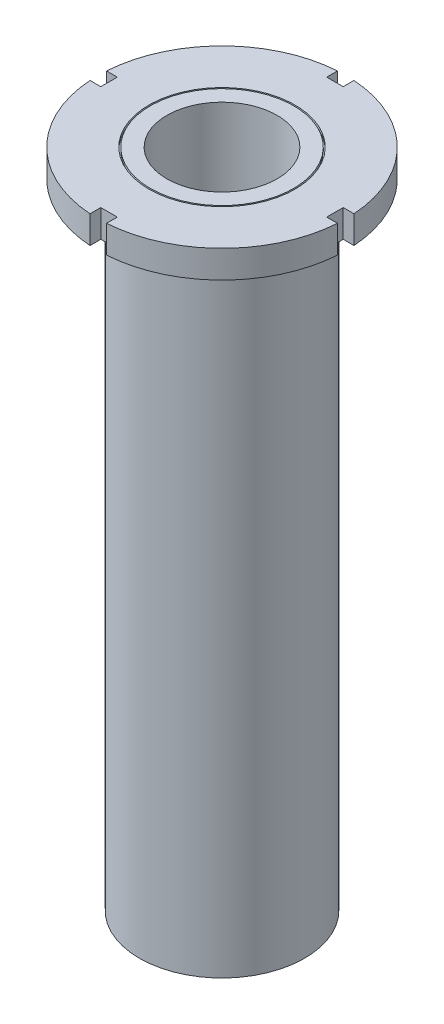
from build123d import *

# Parameters (mm, degrees)
SKETCH1_R           = 15
BOSS_EXTRUDE1_DEPTH = 115
BOSS_EXTRUDE2_DEPTH = 5
SKETCH3_R           = 13.25
SKETCH3_R_2         = 13
CUT_EXTRUDE1_DEPTH  = 0.5
SKETCH4_R           = 10
CUT_EXTRUDE2_DEPTH  = 125.128965193
SKETCH5_R           = 1.5
BOSS_EXTRUDE3_DEPTH = 10.35


with BuildPart() as part:
    # Sketch1 → Boss-Extrude1 (new body)
    with BuildSketch(Plane(origin=(0, 0, 0), x_dir=(1, 0, 0), z_dir=(0, 1, 0))):
        with Locations(Location((0, 0, 0), (0, 0, 270))):
            Circle(SKETCH1_R)
    extrude(amount=BOSS_EXTRUDE1_DEPTH)

    # Sketch2 → Boss-Extrude2 (add)
    with BuildSketch(Plane(origin=(0, 115, 0), x_dir=(1, 0, 0), z_dir=(0, 1, 0))):
        with BuildLine():
            Line((-1.5, 20.5), (1.5, 20.5))
            Line((1.5, 20.5), (1.5, 22.449944321))
            ThreePointArc((1.5, 22.449944321), (15.909902577, 15.909902577), (22.449944321, 1.5))
            Line((22.449944321, 1.5), (20.5, 1.5))
            Line((20.5, 1.5), (20.5, -1.5))
            Line((20.5, -1.5), (22.449944321, -1.5))
            ThreePointArc((22.449944321, -1.5), (15.909902577, -15.909902577), (1.5, -22.449944321))
            Line((1.5, -22.449944321), (1.5, -20.5))
            Line((1.5, -20.5), (-1.5, -20.5))
            Line((-1.5, -20.5), (-1.5, -22.449944321))
            ThreePointArc((-1.5, -22.449944321), (-15.909902577, -15.909902577), (-22.449944321, -1.5))
            Line((-22.449944321, -1.5), (-20.5, -1.5))
            Line((-20.5, -1.5), (-20.5, 1.5))
            Line((-20.5, 1.5), (-22.449944321, 1.5))
            ThreePointArc((-22.449944321, 1.5), (-15.909902577, 15.909902577), (-1.5, 22.449944321))
            Line((-1.5, 22.449944321), (-1.5, 20.5))
        make_face()
    extrude(amount=BOSS_EXTRUDE2_DEPTH)

    # Sketch3 → Cut-Extrude1 (cut)
    with BuildSketch(Plane(origin=(0, 120, 0), x_dir=(1, 0, 0), z_dir=(0, 1, 0))):
        with Locations(Location((0, 0, 0), (0, 0, 270))):
            Circle(SKETCH3_R)
        with Locations(Location((0, 0, 0), (0, 0, 270))):
            Circle(SKETCH3_R_2, mode=Mode.SUBTRACT)
    extrude(amount=-CUT_EXTRUDE1_DEPTH, mode=Mode.SUBTRACT)

    # Sketch4 → Cut-Extrude2 (cut, through all)
    with BuildSketch(Plane(origin=(0, 120, 0), x_dir=(1, 0, 0), z_dir=(0, 1, 0))):
        with Locations(Location((0, 0, 0), (0, 0, 270))):
            Circle(SKETCH4_R)
    extrude(amount=-CUT_EXTRUDE2_DEPTH, mode=Mode.SUBTRACT)

    # Sketch5 → Boss-Extrude3 (add, symmetric)
    with BuildSketch(Plane(origin=(0, 0, 0), x_dir=(0, 0, -1), z_dir=(1, 0, 0))):
        with Locations(Location((0, 97.584149944, 0), (0, 0, 180))):
            Circle(SKETCH5_R)
    extrude(amount=BOSS_EXTRUDE3_DEPTH, both=True)


solid = part.part
